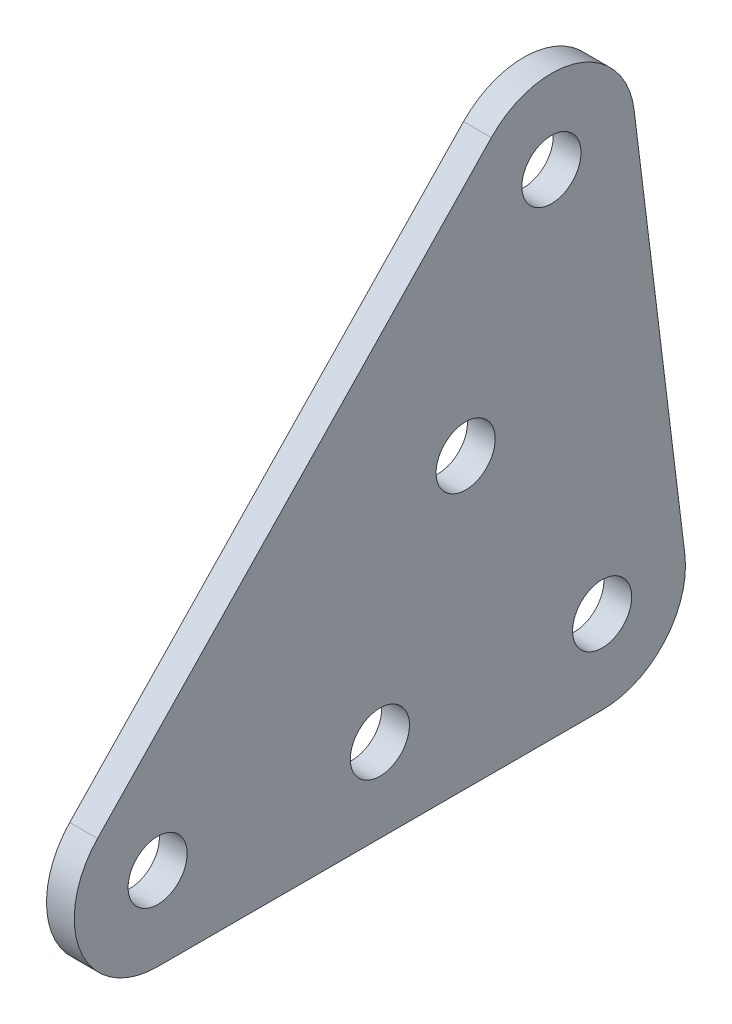
from build123d import *

# Parameters (mm, degrees)
BOSS_EXTRUDE1_START     = 92.868812
BOSS_EXTRUDE1_DEPTH     = 3.175
F_1_4_CLEARANCE_HOLE1_D = 6.7564


with BuildPart() as part:
    # Sketch1 → Boss-Extrude1 (new body)
    with BuildSketch(Plane(origin=(0, 0, 0), x_dir=(0, 0, -1), z_dir=(1, 0, 0)).offset(BOSS_EXTRUDE1_START)):
        with BuildLine():
            Line((-1155.791403712, 192.93801872), (-1149.996384364, 146.073482729))
            ThreePointArc((-1149.996384364, 146.073482729), (-1152.312880663, 138.596176396), (-1159.44938805, 135.379574554))
            Line((-1159.44938805, 135.379574554), (-1210.24938805, 135.379574554))
            ThreePointArc((-1210.24938805, 135.379574554), (-1219.012005401, 141.170654074), (-1217.119501727, 151.502086438))
            Line((-1217.119501727, 151.502086438), (-1172.114521075, 198.366622429))
            ThreePointArc((-1172.114521075, 198.366622429), (-1162.238535685, 200.807382517), (-1155.791403712, 192.93801872))
        make_face()
    extrude(amount=BOSS_EXTRUDE1_DEPTH)

    # 1/4 Clearance Hole1 (through all)
    with Locations(Plane(origin=(96.043812484, 0, 0), x_dir=(0, 0, -1), z_dir=(1, 0, 0))):
        with Locations((-1175.046897724, 168.336842549), (-1165.244407398, 191.769110545), (-1210.24938805, 144.904574554), (-1184.84938805, 144.904574554), (-1159.44938805, 144.904574554)):
            Hole(F_1_4_CLEARANCE_HOLE1_D / 2)


solid = part.part
